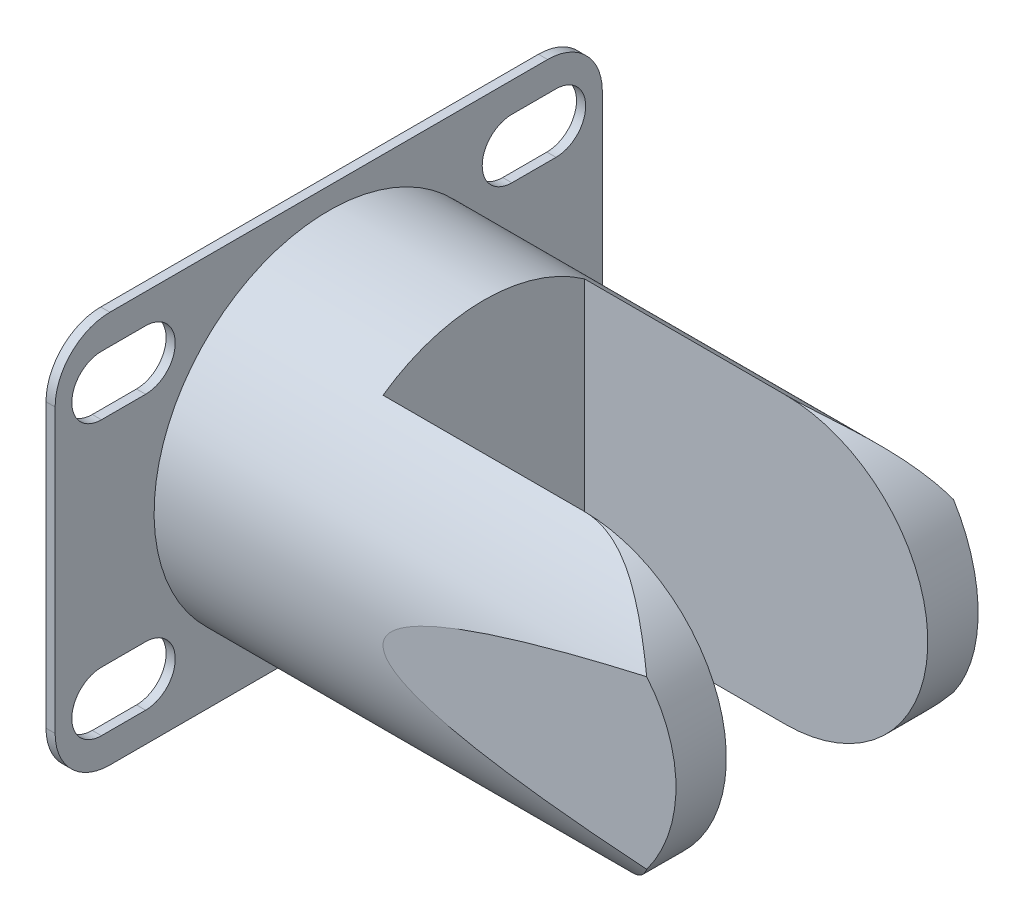
from build123d import *

# Parameters (mm, degrees)
SKETCH_1_R                     = 1.5
EXTRUDE_1_DEPTH                = 1
SKETCH_2_R                     = 19.148010015
EXTRUDE_2_DEPTH                = 59
SKETCH_3_W                     = 18.03673264
SKETCH_3_H                     = 38.517695405
CUT_EXTRUDE_1_DEPTH            = 56
CUT_EXTRUDE_1_DRAFT            = -5
CUT_EXTRUDE_1_PROFILE_2_DEPTH  = 56
CUT_EXTRUDE_1_PROFILE_2_DRAFT  = -5
SKETCH_4_R                     = 20
EXTRUDE_3_DEPTH                = 10
SKETCH_5_W                     = 22.090311304
SKETCH_5_H                     = 43.24098638
CUT_EXTRUDE_2_DEPTH            = 42
CUT_EXTRUDE_3_DEPTH            = 71.443239562
CUT_EXTRUDE_3_DEPTH_BACK       = 71.443239562
SPLIT_BODIES_1_SURFACE_1_BACK  = 96.126
SPLIT_BODIES_1_SURFACE_1_DEPTH = 192.252
SPLIT_BODIES_1_SURFACE_2_BACK  = 96.126
SPLIT_BODIES_1_SURFACE_2_DEPTH = 192.252
MOVE_BODY_1_ANGLE              = 90
CUT_EXTRUDE_4_DEPTH            = 10


with BuildPart() as part:
    # 草图1 → 凸台-拉伸1 (new body)
    with BuildSketch(Plane(origin=(0, 0, 0), x_dir=(0, 0, -1), z_dir=(1, 0, 0))):
        with BuildLine():
            Line((-15.5, -30), (15.5, -30))
            ThreePointArc((15.5, -30), (19.742640687, -28.242640687), (21.5, -24))
            Line((21.5, -24), (21.5, 24))
            ThreePointArc((21.5, 24), (19.742640687, 28.242640687), (15.5, 30))
            Line((15.5, 30), (-15.5, 30))
            ThreePointArc((-15.5, 30), (-19.742640687, 28.242640687), (-21.5, 24))
            Line((-21.5, 24), (-21.5, -24))
            ThreePointArc((-21.5, -24), (-19.742640687, -28.242640687), (-15.5, -30))
        make_face()
        with Locations((15, 22.5)):
            Circle(SKETCH_1_R, mode=Mode.SUBTRACT)
        with Locations(Location((-15, 22.5, 0), (0, 0, 180))):
            Circle(SKETCH_1_R, mode=Mode.SUBTRACT)
        with Locations(Location((15, -22.5, 0), (0, 0, 180))):
            Circle(SKETCH_1_R, mode=Mode.SUBTRACT)
        with Locations((-15, -22.5)):
            Circle(SKETCH_1_R, mode=Mode.SUBTRACT)
    extrude(amount=EXTRUDE_1_DEPTH)

    # 草图2 → 凸台-拉伸2 (add)
    with BuildSketch(Plane(origin=(1, 0, 0), x_dir=(0, 0, -1), z_dir=(1, 0, 0))):
        Circle(SKETCH_2_R)
    extrude(amount=EXTRUDE_2_DEPTH)


with BuildPart() as cut_extrude_1_tool:
    # 草图3 → 切除-拉伸1 (with draft: the straight prism first)
    with BuildSketch(Plane(origin=(60, 0, 0), x_dir=(0, 0, -1), z_dir=(1, 0, 0))):
        with Locations((-25.200855418, 1.306398859)):
            Rectangle(SKETCH_3_W, SKETCH_3_H)
    extrude(amount=-CUT_EXTRUDE_1_DEPTH)
    # 切除-拉伸1: the draft: its side faces are tilted about the plane it starts from
    cut_extrude_1_sides = [cut_extrude_1_tool.faces().sort_by_distance(p)[0] for p in [
        (32, 1.306398859, 34.219221738),
        (32, -17.952448843, 25.200855418),
        (32, 1.306398859, 16.182489098),
        (32, 20.565246562, 25.200855418),
    ]]
    draft(cut_extrude_1_sides, Plane(origin=(60, 0, 0), x_dir=(0, 0, -1), z_dir=(1, 0, 0)), CUT_EXTRUDE_1_DRAFT)


with BuildPart() as part_1:
    add(part.part)

    # 切除-拉伸1: cut by cut_extrude_1_tool
    add(cut_extrude_1_tool.part, mode=Mode.SUBTRACT)


with BuildPart() as cut_extrude_1_profile_2_tool:
    # 草图3 → 切除-拉伸1 profile 2 (with draft: the straight prism first)
    with BuildSketch(Plane(origin=(60, 0, 0), x_dir=(0, 0, -1), z_dir=(1, 0, 0))):
        with Locations((25.200855418, 1.306398859)):
            Rectangle(SKETCH_3_W, SKETCH_3_H)
    extrude(amount=-CUT_EXTRUDE_1_PROFILE_2_DEPTH)
    # 切除-拉伸1 profile 2: the draft: its side faces are tilted about the plane it starts from
    cut_extrude_1_profile_2_sides = [cut_extrude_1_profile_2_tool.faces().sort_by_distance(p)[0] for p in [
        (32, 1.306398859, -16.182489098),
        (32, -17.952448843, -25.200855418),
        (32, 1.306398859, -34.219221738),
        (32, 20.565246562, -25.200855418),
    ]]
    draft(cut_extrude_1_profile_2_sides, Plane(origin=(60, 0, 0), x_dir=(0, 0, -1), z_dir=(1, 0, 0)), CUT_EXTRUDE_1_PROFILE_2_DRAFT)


with BuildPart() as part_2:
    add(part_1.part)

    # 切除-拉伸1 profile 2: cut by cut_extrude_1_profile_2_tool
    add(cut_extrude_1_profile_2_tool.part, mode=Mode.SUBTRACT)

    # 草图5 → 切除-拉伸2 (cut)
    with BuildSketch(Plane(origin=(60, 0, 0), x_dir=(0, 0, -1), z_dir=(1, 0, 0))):
        Rectangle(SKETCH_5_W, SKETCH_5_H)
    extrude(amount=-CUT_EXTRUDE_2_DEPTH, mode=Mode.SUBTRACT)

    # 草图6 → 切除-拉伸3 (cut, two sides: drawn at the far end of the back side and taken through both)
    with BuildSketch(Plane.XY.offset(-CUT_EXTRUDE_3_DEPTH_BACK)):
        with BuildLine():
            Line((40, 15.641317852), (60, 15.641317852))
            Line((60, 15.641317852), (60, -15.641317852))
            Line((60, -15.641317852), (40, -15.641317852))
            ThreePointArc((40, -15.641317852), (55.641317852, 0), (40, 15.641317852))
        make_face()
    extrude(amount=CUT_EXTRUDE_3_DEPTH + CUT_EXTRUDE_3_DEPTH_BACK, mode=Mode.SUBTRACT)


with BuildPart() as body_2:
    # 草图4 → 凸台-拉伸3 (new, symmetric)
    with BuildSketch(Plane.XY):
        with Locations((40, 0)):
            Circle(SKETCH_4_R)
    extrude(amount=EXTRUDE_3_DEPTH, both=True)


with BuildPart() as body_3:
    # Split Bodies 1: the piece behind the surface
    add(part_2.part)
    # Split Bodies 1 surface: a surface, the sketch's curves swept straight by 192.252 mm
    with BuildLine(Plane(origin=(0, 0, -21.5), x_dir=(-1, 0, 0), z_dir=(0, 0, -1)).offset(-SPLIT_BODIES_1_SURFACE_1_BACK), mode=Mode.PRIVATE) as split_bodies_1_surface_1_path:
        Line((-1, 32.867320156), (-1, -33.990989222))
    split_bodies_1_surface_1 = Shell.extrude(split_bodies_1_surface_1_path.wire(), (0 * SPLIT_BODIES_1_SURFACE_1_DEPTH, 0 * SPLIT_BODIES_1_SURFACE_1_DEPTH, -1 * SPLIT_BODIES_1_SURFACE_1_DEPTH))
    split(bisect_by=split_bodies_1_surface_1, keep=Keep.BOTTOM)


with BuildPart() as part_3:
    add(part_2.part)

    # Split Bodies 1: split by a surface, the side it looks to stays
    # Split Bodies 1 surface: a surface, the sketch's curves swept straight by 192.252 mm
    with BuildLine(Plane(origin=(0, 0, -21.5), x_dir=(-1, 0, 0), z_dir=(0, 0, -1)).offset(-SPLIT_BODIES_1_SURFACE_2_BACK), mode=Mode.PRIVATE) as split_bodies_1_surface_2_path:
        Line((-1, 32.867320156), (-1, -33.990989222))
    split_bodies_1_surface_2 = Shell.extrude(split_bodies_1_surface_2_path.wire(), (0 * SPLIT_BODIES_1_SURFACE_2_DEPTH, 0 * SPLIT_BODIES_1_SURFACE_2_DEPTH, -1 * SPLIT_BODIES_1_SURFACE_2_DEPTH))
    split(bisect_by=split_bodies_1_surface_2, keep=Keep.TOP)


with BuildPart() as part_4:
    # Move Body 1: moved
    add(part_3.part.rotate(Axis((0, 0, 0), (1, 0, 0)), MOVE_BODY_1_ANGLE))

    # 草图8 → 切除-拉伸4 (cut)
    with BuildSketch(Plane.ZY):
        with BuildLine():
            Line((20.07870017, 18.25), (24.92129983, 18.25))
            ThreePointArc((24.92129983, 18.25), (28.17129983, 15), (24.92129983, 11.75))
            Line((24.92129983, 11.75), (20.07870017, 11.75))
            ThreePointArc((20.07870017, 11.75), (16.82870017, 15), (20.07870017, 18.25))
        make_face()
        with BuildLine():
            Line((20.07870017, -18.25), (24.92129983, -18.25))
            ThreePointArc((24.92129983, -18.25), (28.17129983, -15), (24.92129983, -11.75))
            Line((24.92129983, -11.75), (20.07870017, -11.75))
            ThreePointArc((20.07870017, -11.75), (16.82870017, -15), (20.07870017, -18.25))
        make_face()
        with BuildLine():
            Line((-20.07870017, -18.25), (-24.92129983, -18.25))
            ThreePointArc((-24.92129983, -18.25), (-28.17129983, -15), (-24.92129983, -11.75))
            Line((-24.92129983, -11.75), (-20.07870017, -11.75))
            ThreePointArc((-20.07870017, -11.75), (-16.82870017, -15), (-20.07870017, -18.25))
        make_face()
        with BuildLine():
            Line((-20.07870017, 18.25), (-24.92129983, 18.25))
            ThreePointArc((-24.92129983, 18.25), (-28.17129983, 15), (-24.92129983, 11.75))
            Line((-24.92129983, 11.75), (-20.07870017, 11.75))
            ThreePointArc((-20.07870017, 11.75), (-16.82870017, 15), (-20.07870017, 18.25))
        make_face()
    extrude(amount=-CUT_EXTRUDE_4_DEPTH, mode=Mode.SUBTRACT)


solid = Compound([body_3.part, part_4.part])
